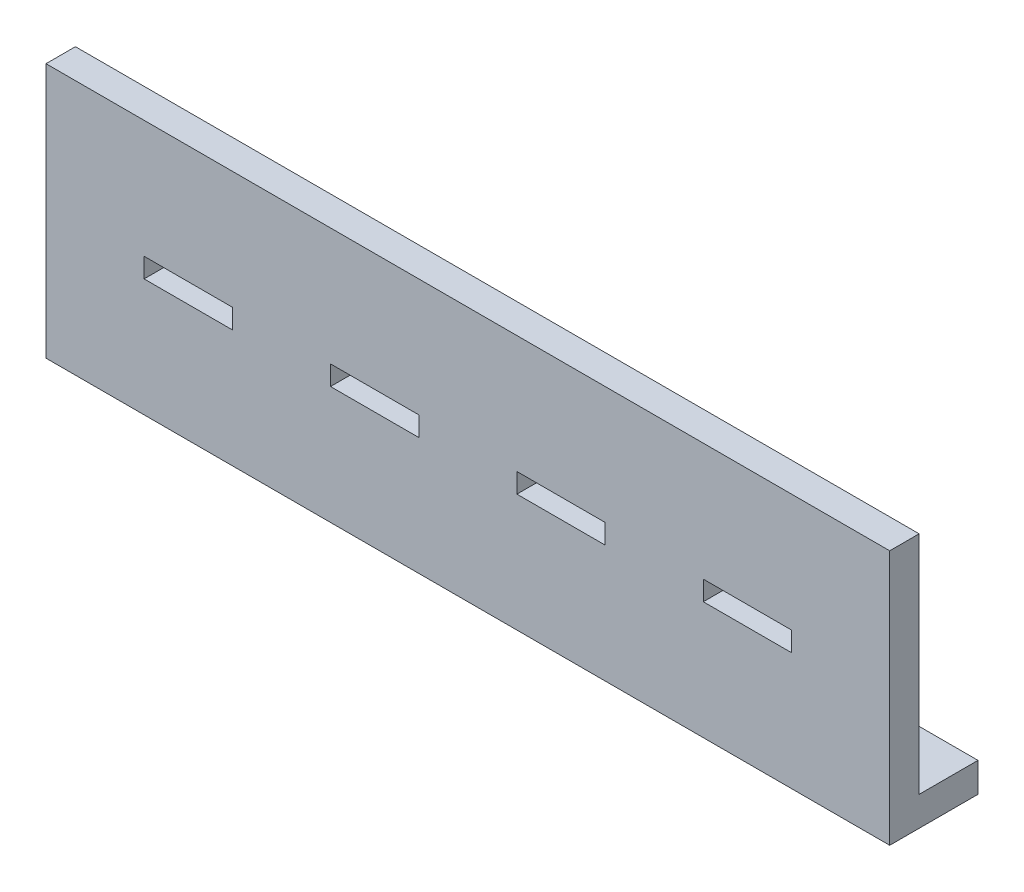
from build123d import *

# Parameters (mm, degrees)
SKETCH_1_W          = 86
SKETCH_1_H          = 26
SKETCH_1_W_2        = 9
SKETCH_1_H_2        = 2
EXTRUDE_1_DEPTH     = 1.5
SKETCH_3_W          = 86
SKETCH_3_H          = 3
EXTRUDE_2_DEPTH     = 6
SKETCH_4_R          = 2
CUT_EXTRUDE_1_DEPTH = 6


with BuildPart() as part:
    # 草图1 → 凸台-拉伸1 (new, symmetric)
    with BuildSketch(Plane.XY):
        with Locations((43, 13)):
            Rectangle(SKETCH_1_W, SKETCH_1_H)
        with Locations((14.5, 13)):
            Rectangle(SKETCH_1_W_2, SKETCH_1_H_2, mode=Mode.SUBTRACT)
        with Locations((33.5, 13)):
            Rectangle(SKETCH_1_W_2, SKETCH_1_H_2, mode=Mode.SUBTRACT)
        with Locations((52.5, 13)):
            Rectangle(SKETCH_1_W_2, SKETCH_1_H_2, mode=Mode.SUBTRACT)
        with Locations((71.5, 13)):
            Rectangle(SKETCH_1_W_2, SKETCH_1_H_2, mode=Mode.SUBTRACT)
    extrude(amount=EXTRUDE_1_DEPTH, both=True)

    # 草图3 → 凸台-拉伸2 (add)
    with BuildSketch(Plane(origin=(0, 0, -1.5), x_dir=(-1, 0, 0), z_dir=(0, 0, -1))):
        with Locations((-43, 1.5)):
            Rectangle(SKETCH_3_W, SKETCH_3_H)
    extrude(amount=EXTRUDE_2_DEPTH)

    # 草图4 → 切除-拉伸1 (cut)
    with BuildSketch(Plane(origin=(0, 3, 0), x_dir=(1, 0, 0), z_dir=(0, 1, 0))):
        with Locations(Location((10, 4.5, 0), (0, 0, 270))):
            Circle(SKETCH_4_R)
        with Locations(Location((76, 4.5, 0), (0, 0, 270))):
            Circle(SKETCH_4_R)
    extrude(amount=-CUT_EXTRUDE_1_DEPTH, mode=Mode.SUBTRACT)


solid = part.part
